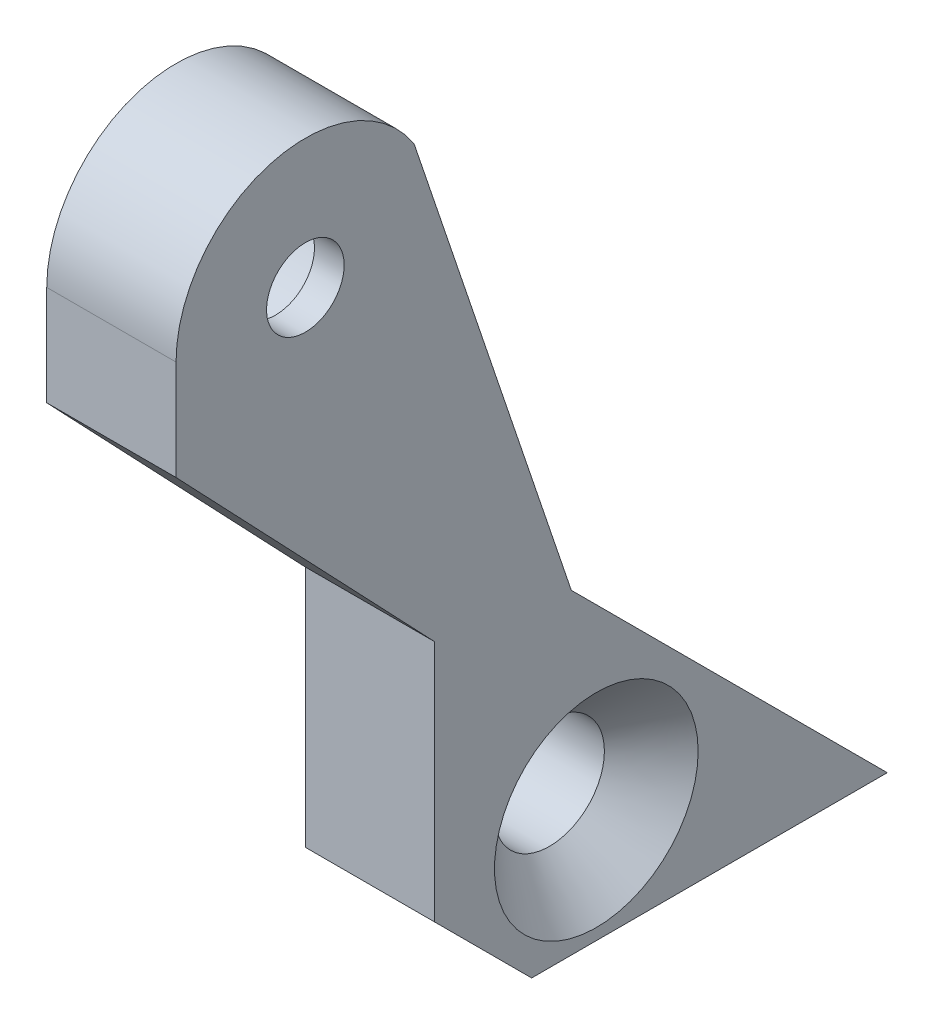
from build123d import *

# Parameters (mm, degrees)
RESSALTO_EXTRUS_O1_DEPTH                             = 4
FURO_DE_DI_METRO_6_0_6_1_D                           = 6
FURO_DE_DI_METRO_6_0_6_1_DEPTH                       = 2
FURO_DE_DI_METRO_6_0_6_1_TIP                         = 1.802581857
ESBO_O4_R                                            = 1.2
CORTE_EXTRUS_O1_DEPTH                                = 30.283417381
ESCAREADO_PARA_PARAFUSO_COM_CABE_A_ESCAR_D           = 3.4
ESCAREADO_PARA_PARAFUSO_COM_CABE_A_ESCAR_CSINK_D     = 6.3
ESCAREADO_PARA_PARAFUSO_COM_CABE_A_ESCAR_CSINK_ANGLE = 90


with BuildPart() as part:
    # Esboço1 → Ressalto-extrusão1 (new body)
    with BuildSketch(Plane(origin=(0, 0, 0), x_dir=(0, 0, -1), z_dir=(1, 0, 0))):
        with BuildLine():
            Line((0, 0), (0, 3.091839499))
            ThreePointArc((0, 3.091839499), (2.870368785, 6.92901728), (7.361966659, 5.259137398))
            Line((7.361966659, 5.259137398), (12.225984495, -9.134144996))
            Line((12.225984495, -9.134144996), (22, -18.908160501))
            Line((22, -18.908160501), (11, -18.908160501))
            Line((11, -18.908160501), (8, -15.908160501))
            Line((8, -15.908160501), (8, -8.399335203))
            Line((8, -8.399335203), (0, 0))
        make_face()
    extrude(amount=RESSALTO_EXTRUS_O1_DEPTH)

    # Furo de diâmetro Ø6.0 (6)1
    with Locations(Plane.ZY):
        with Locations((-4, 3.091839499)):
            Hole(FURO_DE_DI_METRO_6_0_6_1_D / 2, depth=FURO_DE_DI_METRO_6_0_6_1_DEPTH)
            with Locations((0, 0, -(FURO_DE_DI_METRO_6_0_6_1_DEPTH + FURO_DE_DI_METRO_6_0_6_1_TIP / 2))):  # 118° drill point
                Cone(0, FURO_DE_DI_METRO_6_0_6_1_D / 2, FURO_DE_DI_METRO_6_0_6_1_TIP, mode=Mode.SUBTRACT)

    # Esboço4 → Corte-extrusão1 (cut, through all)
    with BuildSketch(Plane(origin=(4, 0, 0), x_dir=(0, 0, -1), z_dir=(1, 0, 0))):
        with Locations((4, 3.091839499)):
            Circle(ESBO_O4_R)
    extrude(amount=-CORTE_EXTRUS_O1_DEPTH, mode=Mode.SUBTRACT)

    # Escareado para parafuso com cabeça escareada chata de M31 (through all)
    with Locations(Plane(origin=(4, 0, 0), x_dir=(0, 0, -1), z_dir=(1, 0, 0))):
        with Locations((13, -15.408160501)):
            CounterSinkHole(ESCAREADO_PARA_PARAFUSO_COM_CABE_A_ESCAR_D / 2, ESCAREADO_PARA_PARAFUSO_COM_CABE_A_ESCAR_CSINK_D / 2, counter_sink_angle=ESCAREADO_PARA_PARAFUSO_COM_CABE_A_ESCAR_CSINK_ANGLE)


solid = part.part
